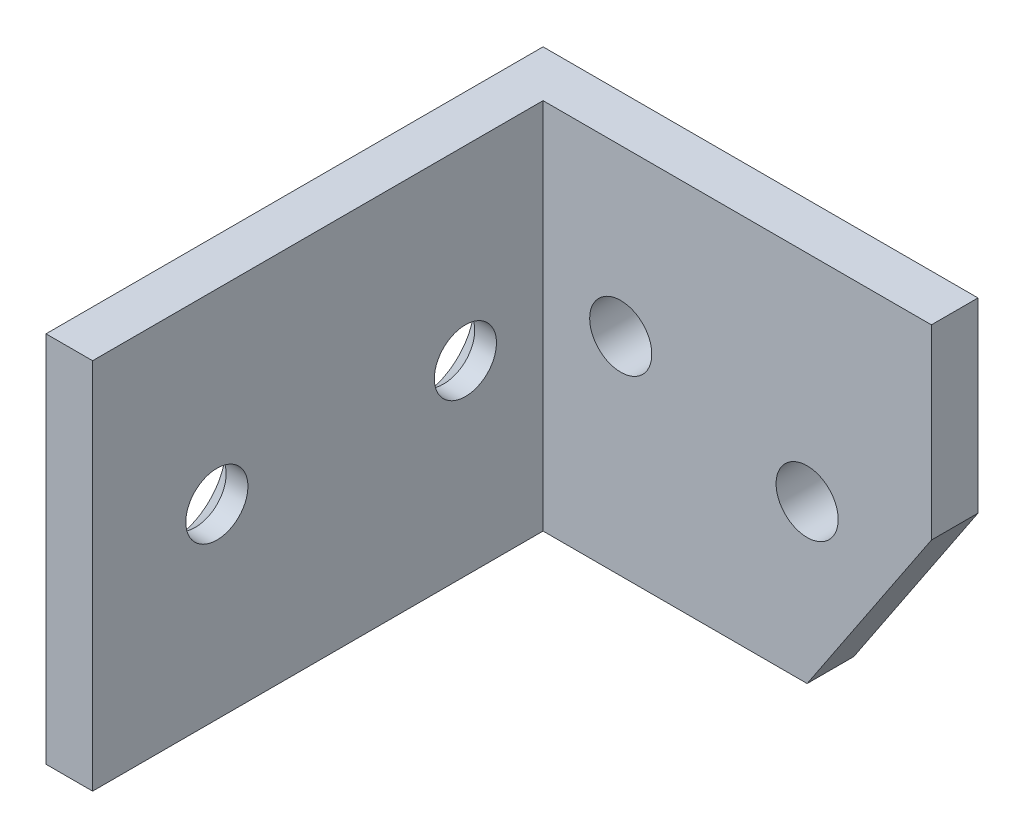
from build123d import *

# Parameters (mm, degrees)
BOSS_EXTRUDE1_DEPTH     = 38.1
CUT_EXTRUDE1_REACH      = 79.512
SKETCH2_R               = 3.175
CUT_EXTRUDE2_REACH      = 79.512
SKETCH4_R               = 3.175
CHAMFER1_SIZE           = 2.54
CUT_EXTRUDE3_DEPTH      = 78.51162816
CUT_EXTRUDE3_DEPTH_BACK = 78.51162816


with BuildPart() as part:
    # Sketch1 → Boss-Extrude1 (new body)
    with BuildSketch(Plane(origin=(0, 0, 0), x_dir=(1, 0, 0), z_dir=(0, 1, 0))):
        Polygon((0, 0), (0, 50.8), (44.45, 50.8), (44.45, 46.0375), (4.7625, 46.0375), (4.7625, 0), align=None)
    extrude(amount=BOSS_EXTRUDE1_DEPTH)

    # Sketch2 → Cut-Extrude1 (cut, up to next)
    with BuildSketch(Plane(origin=(0, 0, -50.8), x_dir=(-1, 0, 0), z_dir=(0, 0, -1)), mode=Mode.PRIVATE) as cut_extrude1_sk1:
        with Locations((-12.7, 21.20738686)):
            Circle(SKETCH2_R)
    cut_extrude1_tool1 = extrude(cut_extrude1_sk1.sketch, amount=-CUT_EXTRUDE1_REACH, mode=Mode.PRIVATE) & part.part
    # Sketch2 → Cut-Extrude1 (cut, up to next)
    with BuildSketch(Plane(origin=(0, 0, -50.8), x_dir=(-1, 0, 0), z_dir=(0, 0, -1)), mode=Mode.PRIVATE) as cut_extrude1_sk2:
        with Locations((-31.75, 16.102954744)):
            Circle(SKETCH2_R)
    cut_extrude1_tool2 = extrude(cut_extrude1_sk2.sketch, amount=-CUT_EXTRUDE1_REACH, mode=Mode.PRIVATE) & part.part
    add(cut_extrude1_tool1.solids().sort_by_distance((12.7, 21.207387, -50.8))[0], mode=Mode.SUBTRACT)
    add(cut_extrude1_tool2.solids().sort_by_distance((31.75, 16.102955, -50.8))[0], mode=Mode.SUBTRACT)

    # Sketch4 → Cut-Extrude2 (cut, up to next)
    with BuildSketch(Plane.ZY, mode=Mode.PRIVATE) as cut_extrude2_sk1:
        with Locations((-12.7, 19.05)):
            Circle(SKETCH4_R)
    cut_extrude2_tool1 = extrude(cut_extrude2_sk1.sketch, amount=-CUT_EXTRUDE2_REACH, mode=Mode.PRIVATE) & part.part
    # Sketch4 → Cut-Extrude2 (cut, up to next)
    with BuildSketch(Plane.ZY, mode=Mode.PRIVATE) as cut_extrude2_sk2:
        with Locations((-38.1, 19.05)):
            Circle(SKETCH4_R)
    cut_extrude2_tool2 = extrude(cut_extrude2_sk2.sketch, amount=-CUT_EXTRUDE2_REACH, mode=Mode.PRIVATE) & part.part
    add(cut_extrude2_tool1.solids().sort_by_distance((0, 19.05, -12.7))[0], mode=Mode.SUBTRACT)
    add(cut_extrude2_tool2.solids().sort_by_distance((0, 19.05, -38.1))[0], mode=Mode.SUBTRACT)

    # Chamfer1
    chamfer1_edges = [part.edges().sort_by_distance(p)[0] for p in [
        (0, 19.05, -15.875),
        (0, 19.05, -41.275),
    ]]
    chamfer(chamfer1_edges, length=CHAMFER1_SIZE)

    # Sketch5 → Cut-Extrude3 (cut, two sides: drawn at the far end of the back side and taken through both)
    with BuildSketch(Plane(origin=(0, 0, -50.8), x_dir=(-1, 0, 0), z_dir=(0, 0, -1)).offset(-CUT_EXTRUDE3_DEPTH_BACK)):
        Polygon((28.817809215, -90.851713823), (-31.75, 0), (-44.45, 19.05), (-105.017809215, 109.901713823), (-286.721236861, -11.233904608), (-152.88561843, -211.987332253), align=None)
    extrude(amount=CUT_EXTRUDE3_DEPTH + CUT_EXTRUDE3_DEPTH_BACK, mode=Mode.SUBTRACT)


solid = part.part
